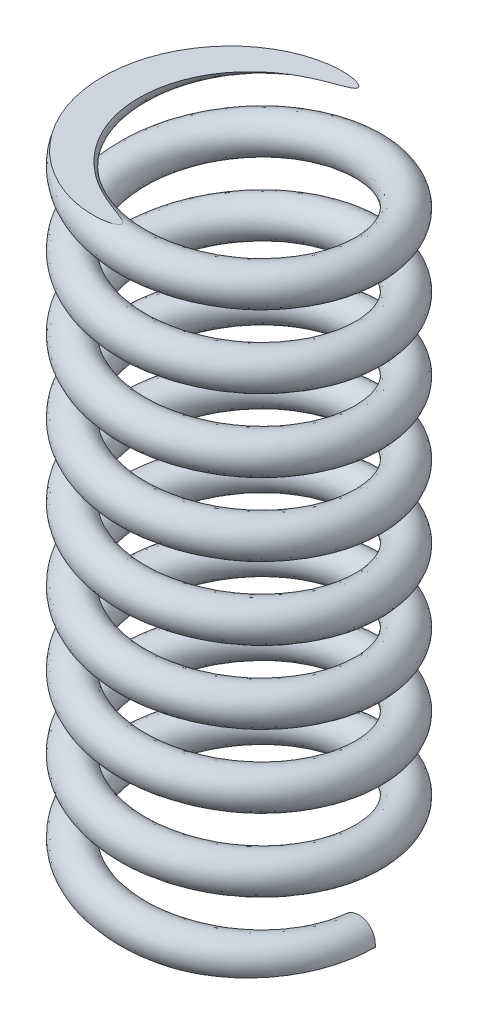
from build123d import *

# Parameters (mm, degrees)
SWEEP1_PITCH        = 2
SWEEP1_HEIGHT       = 18
SWEEP1_RADIUS       = 3.25
SWEEP1_START_ANGLE  = 90
SKETCH2_R           = 0.5
EXTRUDE1_DEPTH      = 10
EXTRUDE1_DEPTH_BACK = 10
SKETCH3_W           = 8
SKETCH3_H           = 3


with BuildPart() as part:
    # Sweep1: sweep along a helix
    with BuildLine() as sweep1_path:
        add(Helix(SWEEP1_PITCH, SWEEP1_HEIGHT, SWEEP1_RADIUS, center=(0, 0, 0), direction=(0, 1, 0), lefthand=True, mode=Mode.PRIVATE).rotate(Axis((0, 0, 0), (0, 1, 0)), SWEEP1_START_ANGLE))
    # Sketch2 → Sweep1 (sweep)
    with BuildSketch(Plane(origin=(3.25, 0, 0), x_dir=(1, 0, 0), z_dir=(4.084159025639519e-15, 0.09747510244715202, 0.9952379637066289))):
        Circle(SKETCH2_R)
    sweep(path=sweep1_path.line, is_frenet=True)

    # Sketch3 → Extrude1 (cut, two sides: drawn at the far end of the back side and taken through both)
    with BuildSketch(Plane.XY.offset(-EXTRUDE1_DEPTH_BACK)):
        with Locations((0, -1.5)):
            Rectangle(SKETCH3_W, SKETCH3_H)
        with Locations((0, 18.5)):
            Rectangle(SKETCH3_W, SKETCH3_H)
    extrude(amount=EXTRUDE1_DEPTH + EXTRUDE1_DEPTH_BACK, mode=Mode.SUBTRACT)


solid = part.part
